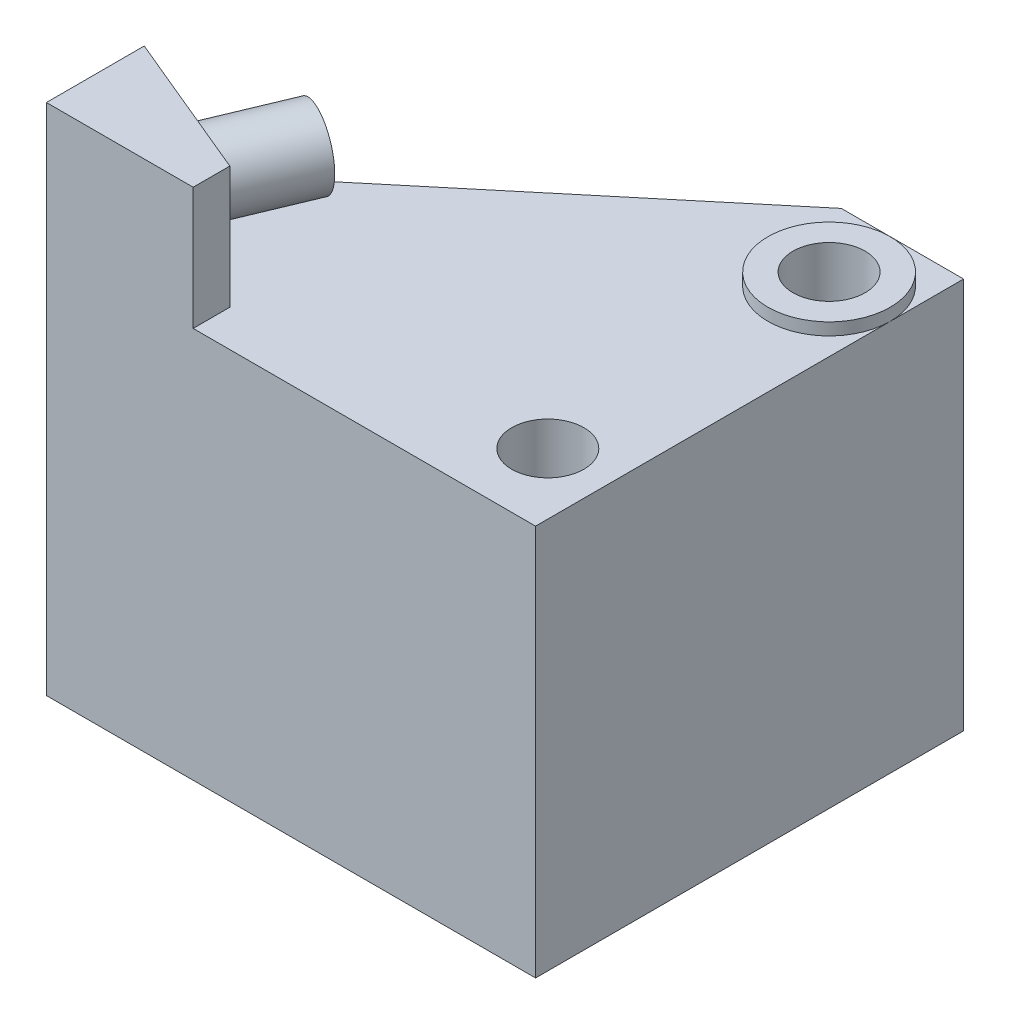
from build123d import *

# Parameters (mm, degrees)
EXTRUDE_1_DEPTH     = 16
SKETCH_3_R          = 1.475
CUT_EXTRUDE_1_DEPTH = 32.020154738
EXTRUDE_2_DEPTH     = 5
EXTRUDE_START       = 0.5
SKETCH_5_R          = 2.5
SKETCH_5_R_2        = 1.475
EXTRUDE_3_DEPTH     = 0.5
SKETCH_6_R          = 1.5
EXTRUDE_4_DEPTH     = 4


with BuildPart() as part:
    # Эскиз2 → Бобышка-Вытянуть1 (new body)
    with BuildSketch(Plane(origin=(0, 0, 0), x_dir=(1, 0, 0), z_dir=(0, 1, 0))):
        Polygon((-20, 5), (-5, 17.5), (0, 17.5), (0, 0), (-20, 0), align=None)
    extrude(amount=EXTRUDE_1_DEPTH)

    # Эскиз3 → Вырез-Вытянуть1 (cut, through all)
    with BuildSketch(Plane(origin=(0, 16, 0), x_dir=(1, 0, 0), z_dir=(0, 1, 0))):
        with Locations(Location((-2.5, 14.5, 0), (0, 0, 270))):
            Circle(SKETCH_3_R)
        with Locations(Location((-2.5, 3, 0), (0, 0, 270))):
            Circle(SKETCH_3_R)
    extrude(amount=-CUT_EXTRUDE_1_DEPTH, mode=Mode.SUBTRACT)

    # Эскиз4 → Бобышка-Вытянуть2 (add)
    with BuildSketch(Plane(origin=(0, 16, 0), x_dir=(1, 0, 0), z_dir=(0, 1, 0))):
        Polygon((-20, 4), (-20, 0), (-14, 0), (-14, 1.5), align=None)
    extrude(amount=EXTRUDE_2_DEPTH)

    # Эскиз5 → Бобышка-Вытянуть3 (add)
    with BuildSketch(Plane(origin=(0, 16, 0), x_dir=(1, 0, 0), z_dir=(0, 1, 0)).offset(EXTRUDE_START)):
        with Locations((-2.5, 14.5)):
            Circle(SKETCH_5_R)
        with Locations(Location((-2.5, 14.5, 0), (0, 0, 270))):
            Circle(SKETCH_5_R_2, mode=Mode.SUBTRACT)
    extrude(amount=-EXTRUDE_3_DEPTH)

    # Эскиз6 → Бобышка-Вытянуть4 (add)
    with BuildSketch(Plane(origin=(-1.538461538, 0, 3.692307692), x_dir=(-0.9230769230769231, 0, -0.3846153846153845), z_dir=(0.3846153846153845, 0, -0.9230769230769231))):
        with Locations(Location((16.75, 18.5, 0), (0, 0, 180))):
            Circle(SKETCH_6_R)
    extrude(amount=EXTRUDE_4_DEPTH)


solid = part.part
